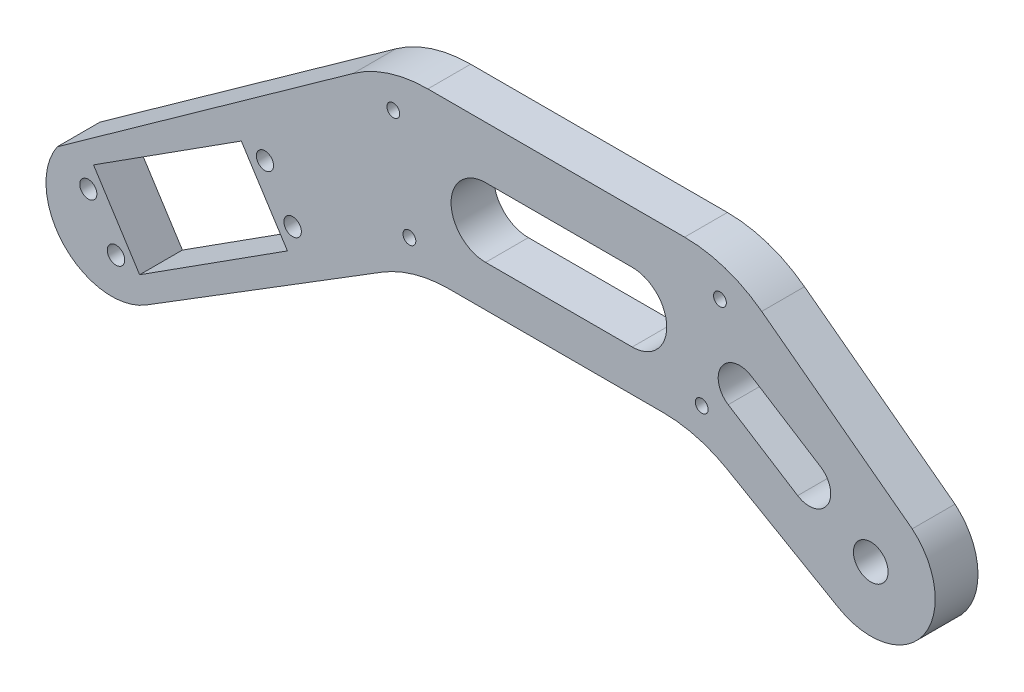
from build123d import *

# Parameters (mm, degrees)
SKETCH1_R           = 4.05
SKETCH1_R_2         = 1.5
SKETCH1_R_3         = 2.004491684
SKETCH1_R_4         = 2.039529922
BOSS_EXTRUDE1_DEPTH = 10


with BuildPart() as part:
    # Sketch1 → Boss-Extrude1 (new body)
    with BuildSketch(Plane.XY):
        with BuildLine():
            Line((-36.50585994, 38), (23.49414006, 38))
            ThreePointArc((23.49414006, 38), (32.993428927, 36.45634395), (41.515142146, 31.984234067))
            Line((41.515142146, 31.984234067), (76.680353084, 5.562196244))
            ThreePointArc((76.680353084, 5.562196244), (79.334029485, -14.607546806), (59.473059994, -19.012365084))
            Line((59.473059994, -19.012365084), (33.489782569, -4.016722575))
            ThreePointArc((33.489782569, -4.016722575), (26.256281428, -1.021574208), (18.49414006, 0))
            Line((18.49414006, 0), (-31.50585994, 0))
            ThreePointArc((-31.50585994, 0), (-39.73032204, -1.149380887), (-47.324581503, -4.509451788))
            Line((-47.324581503, -4.509451788), (-102.315148598, -38.635060317))
            ThreePointArc((-102.315148598, -38.635060317), (-121.459805376, -36.232350563), (-123.106127076, -17.0078734))
            Line((-123.106127076, -17.0078734), (-53.947129798, 32.409057863))
            ThreePointArc((-53.947129798, 32.409057863), (-45.663596127, 36.56809178), (-36.50585994, 38))
        make_face()
        with Locations((66.99963225, -5.970908883)):
            Circle(SKETCH1_R, mode=Mode.SUBTRACT)
        with Locations((-44.575814379, 29.653127509)):
            Circle(SKETCH1_R_2, mode=Mode.SUBTRACT)
        with Locations((-115.847944697, -21.963472834)):
            Circle(SKETCH1_R_3, mode=Mode.SUBTRACT)
        with Locations((-109.381373154, -32.072055944)):
            Circle(SKETCH1_R_4, mode=Mode.SUBTRACT)
        with Locations(Location((-68.10465879, -5.666888812, 0), (0, 0, 180))):
            Circle(SKETCH1_R_4, mode=Mode.SUBTRACT)
        with Locations(Location((-74.571230332, 4.441694298, 0), (0, 0, 180))):
            Circle(SKETCH1_R_3, mode=Mode.SUBTRACT)
        with Locations((-40.818103787, 5.765583384)):
            Circle(SKETCH1_R_2, mode=Mode.SUBTRACT)
        with Locations((31.754938755, 29.566776323)):
            Circle(SKETCH1_R_2, mode=Mode.SUBTRACT)
        with Locations((27.4947716, 5.867993419)):
            Circle(SKETCH1_R_2, mode=Mode.SUBTRACT)
        Polygon((-114.633940841, -16.438421283), (-80.096281883, 5.655698153), (-69.318662645, -11.191940363), (-103.856321604, -33.286059799), align=None, mode=Mode.SUBTRACT)
        with BuildLine():
            Line((-23.016668441, 25.777290149), (11.250740888, 25.781094638))
            ThreePointArc((11.250740888, 25.781094638), (19.317386003, 17.716240499), (11.252531864, 9.649595384))
            Line((11.252531864, 9.649595384), (-23.014877464, 9.645790894))
            ThreePointArc((-23.014877464, 9.645790894), (-31.08152258, 17.710645033), (-23.016668441, 25.777290149))
        make_face(mode=Mode.SUBTRACT)
        with BuildLine():
            Line((39.069043687, 17.688629392), (55.302205937, 7.399981644))
            ThreePointArc((55.302205937, 7.399981644), (56.858473261, 0.45660111), (49.915092727, -1.099666214))
            Line((49.915092727, -1.099666214), (33.681930477, 9.188981534))
            ThreePointArc((33.681930477, 9.188981534), (32.125663153, 16.132362067), (39.069043687, 17.688629392))
        make_face(mode=Mode.SUBTRACT)
    extrude(amount=BOSS_EXTRUDE1_DEPTH)


solid = part.part
